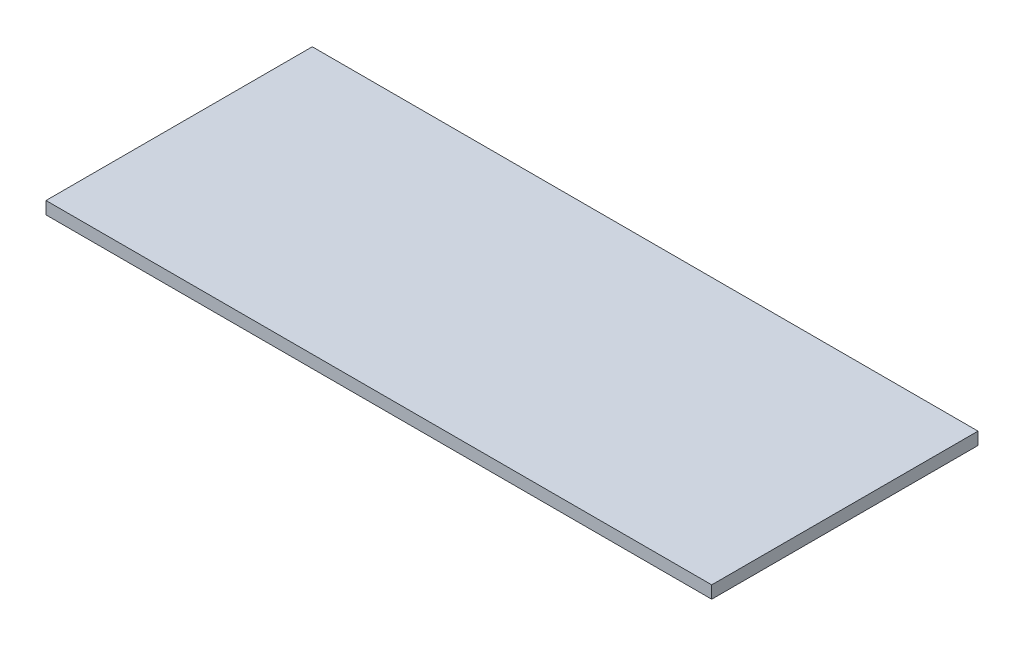
from build123d import *

# Parameters (mm, degrees)
SKETCH1_W           = 254
SKETCH1_H           = 101.6
BOSS_EXTRUDE1_DEPTH = 4.7625


with BuildPart() as part:
    # Sketch1 → Boss-Extrude1 (new body)
    with BuildSketch(Plane(origin=(0, 0, 0), x_dir=(1, 0, 0), z_dir=(0, 1, 0))):
        with Locations((127, 50.8)):
            Rectangle(SKETCH1_W, SKETCH1_H)
    extrude(amount=BOSS_EXTRUDE1_DEPTH)


solid = part.part
